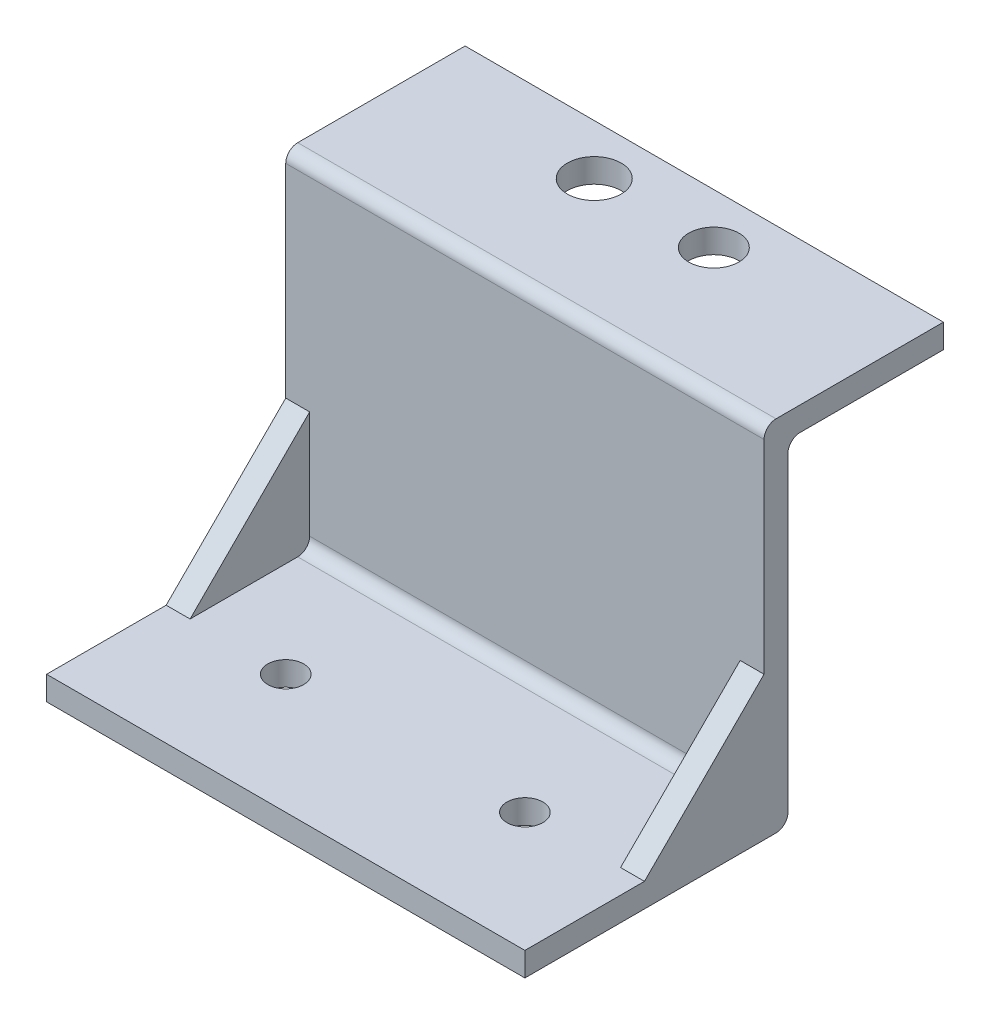
from build123d import *

# Parameters (mm, degrees)
SKETCH1_W           = 40
SKETCH1_H           = 15
SKETCH1_R           = 2.25
SKETCH1_R_2         = 2.1
BOSS_EXTRUDE1_DEPTH = 2
SKETCH2_W           = 40
SKETCH2_H           = 2
BOSS_EXTRUDE2_DEPTH = 28
SKETCH3_W           = 40
SKETCH3_H           = 2
BOSS_EXTRUDE3_DEPTH = 20
SKETCH4_R           = 1.5
CUT_EXTRUDE1_DEPTH  = 20
FILLET1_R           = 1
BOSS_EXTRUDE4_START = 2
BOSS_EXTRUDE4_DEPTH = 2


with BuildPart() as part:
    # Sketch1 → Boss-Extrude1 (new body)
    with BuildSketch(Plane(origin=(0, 0, 0), x_dir=(1, 0, 0), z_dir=(0, 1, 0))):
        with Locations((20, 7.5)):
            Rectangle(SKETCH1_W, SKETCH1_H)
        with Locations(Location((15, 10.8, 0), (0, 0, 270))):
            Circle(SKETCH1_R, mode=Mode.SUBTRACT)
        with Locations(Location((25, 10.8, 0), (0, 0, 270))):
            Circle(SKETCH1_R_2, mode=Mode.SUBTRACT)
    extrude(amount=-BOSS_EXTRUDE1_DEPTH)

    # Sketch2 → Boss-Extrude2 (add)
    with BuildSketch(Plane.XZ.offset(2)):
        with Locations((20, -1)):
            Rectangle(SKETCH2_W, SKETCH2_H)
    extrude(amount=BOSS_EXTRUDE2_DEPTH)

    # Sketch3 → Boss-Extrude3 (add)
    with BuildSketch(Plane.XY):
        with Locations((20, -29)):
            Rectangle(SKETCH3_W, SKETCH3_H)
    extrude(amount=BOSS_EXTRUDE3_DEPTH)

    # Sketch4 → Cut-Extrude1 (cut)
    with BuildSketch(Plane(origin=(0, -28, 0), x_dir=(1, 0, 0), z_dir=(0, 1, 0))):
        with Locations(Location((10, -10, 0), (0, 0, 180))):
            Circle(SKETCH4_R)
        with Locations(Location((30, -10, 0), (0, 0, 180))):
            Circle(SKETCH4_R)
    extrude(amount=-CUT_EXTRUDE1_DEPTH, mode=Mode.SUBTRACT)

    # Fillet1
    fillet1_edges = [part.edges().sort_by_distance(p)[0] for p in [
        (20, -2, -2),
        (20, -30, -2),
        (20, -28, 0),
        (20, 0, 0),
    ]]
    fillet(fillet1_edges, radius=FILLET1_R)

    # Sketch5 → Boss-Extrude4 (add)
    with BuildSketch(Plane(origin=(0, 0, 0), x_dir=(0, 0, -1), z_dir=(1, 0, 0)).offset(BOSS_EXTRUDE4_START)):
        with BuildLine():
            Line((0, -18), (-10, -28))
            Line((-10, -28), (-1, -28))
            ThreePointArc((-1, -28), (-0.292893219, -27.707106781), (0, -27))
            Line((0, -27), (0, -18))
        make_face()
    boss_extrude4 = extrude(amount=-BOSS_EXTRUDE4_DEPTH)

    # Mirror1: Boss-Extrude4 across plane
    add(boss_extrude4.mirror(Plane(origin=(20, 0, 0), x_dir=(0, 0, 1), z_dir=(1, 0, 0))))


solid = part.part
